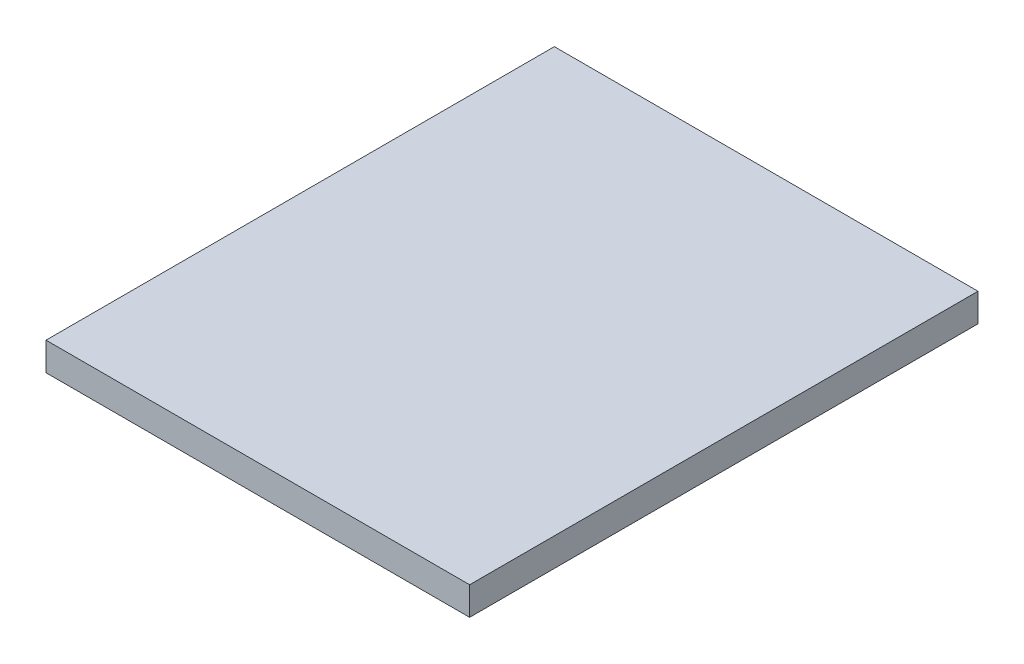
from build123d import *

# Parameters (mm, degrees)
SKETCH1_W           = 90
SKETCH1_H           = 108
BOSS_EXTRUDE1_DEPTH = 6


with BuildPart() as part:
    # Sketch1 → Boss-Extrude1 (new body)
    with BuildSketch(Plane(origin=(0, 0, 0), x_dir=(1, 0, 0), z_dir=(0, 1, 0))):
        Rectangle(SKETCH1_W, SKETCH1_H)
    extrude(amount=BOSS_EXTRUDE1_DEPTH)


solid = part.part
